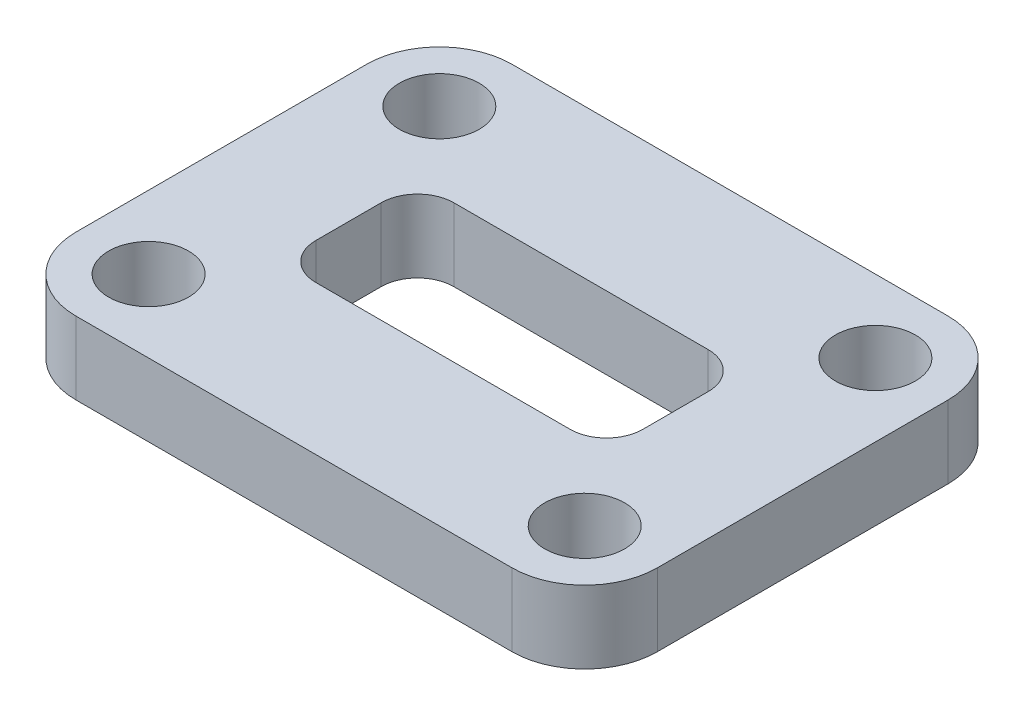
from build123d import *

# Parameters (mm, degrees)
SKETCH_1_W      = 16
SKETCH_1_H      = 12
SKETCH_1_R      = 1.1
SKETCH_1_W_2    = 9
SKETCH_1_H_2    = 3.8
EXTRUDE_1_DEPTH = 2
FILLET_1_R      = 2
FILLET_2_R      = 1


with BuildPart() as part:
    # 草图1 → 凸台-拉伸1 (new body)
    with BuildSketch(Plane(origin=(0, 0, 0), x_dir=(1, 0, 0), z_dir=(0, 1, 0))):
        Rectangle(SKETCH_1_W, SKETCH_1_H)
        with Locations(Location((-6, 4, 0), (0, 0, 270))):
            Circle(SKETCH_1_R, mode=Mode.SUBTRACT)
        with Locations(Location((-6, -4, 0), (0, 0, 270))):
            Circle(SKETCH_1_R, mode=Mode.SUBTRACT)
        with Locations(Location((6, -4, 0), (0, 0, 270))):
            Circle(SKETCH_1_R, mode=Mode.SUBTRACT)
        with Locations(Location((6, 4, 0), (0, 0, 270))):
            Circle(SKETCH_1_R, mode=Mode.SUBTRACT)
        Rectangle(SKETCH_1_W_2, SKETCH_1_H_2, mode=Mode.SUBTRACT)
    extrude(amount=EXTRUDE_1_DEPTH)

    # 圆角1
    fillet_1_edges = [part.edges().sort_by_distance(p)[0] for p in [
        (-8, 1, 6),
        (-8, 1, -6),
        (8, 1, -6),
        (8, 1, 6),
    ]]
    fillet(fillet_1_edges, radius=FILLET_1_R)

    # 圆角2
    fillet_2_edges = [part.edges().sort_by_distance(p)[0] for p in [
        (4.5, 1, -1.9),
        (-4.5, 1, -1.9),
        (-4.5, 1, 1.9),
        (4.5, 1, 1.9),
    ]]
    fillet(fillet_2_edges, radius=FILLET_2_R)


solid = part.part
